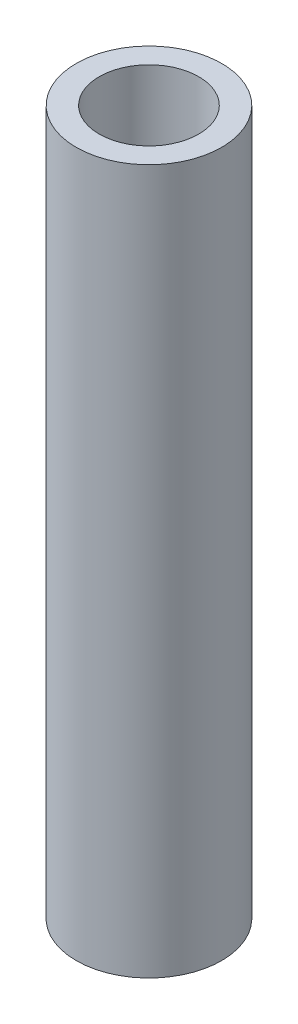
from build123d import *

# Parameters (mm, degrees)
SKETCH1_R           = 4.75
SKETCH1_R_2         = 3.25
BOSS_EXTRUDE1_DEPTH = 46


with BuildPart() as part:
    # Sketch1 → Boss-Extrude1 (new body)
    with BuildSketch(Plane(origin=(0, 0, 0), x_dir=(1, 0, 0), z_dir=(0, 1, 0))):
        with Locations(Location((0, 0, 0), (0, 0, 270))):
            Circle(SKETCH1_R)
        with Locations(Location((0, 0, 0), (0, 0, 270))):
            Circle(SKETCH1_R_2, mode=Mode.SUBTRACT)
    extrude(amount=BOSS_EXTRUDE1_DEPTH)


solid = part.part
